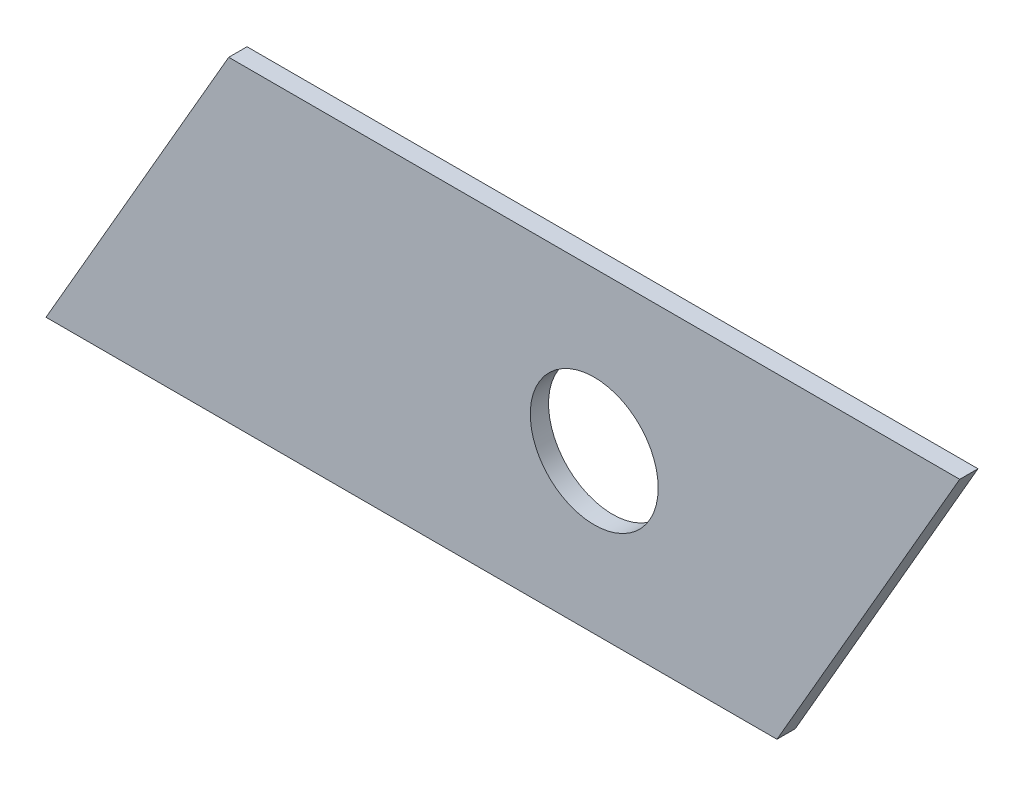
from build123d import *

# Parameters (mm, degrees)
SKETCH_3_R      = 1.75
EXTRUDE_1_DEPTH = 0.5


with BuildPart() as part:
    # 草图3 → 凸台-拉伸1 (new body)
    with BuildSketch(Plane.XY):
        Polygon((0, 0), (5, 8.660254038), (-15, 8.660254038), (-20, 0), align=None)
        with Locations((-5, 4.330127019)):
            Circle(SKETCH_3_R, mode=Mode.SUBTRACT)
    extrude(amount=EXTRUDE_1_DEPTH)


solid = part.part
